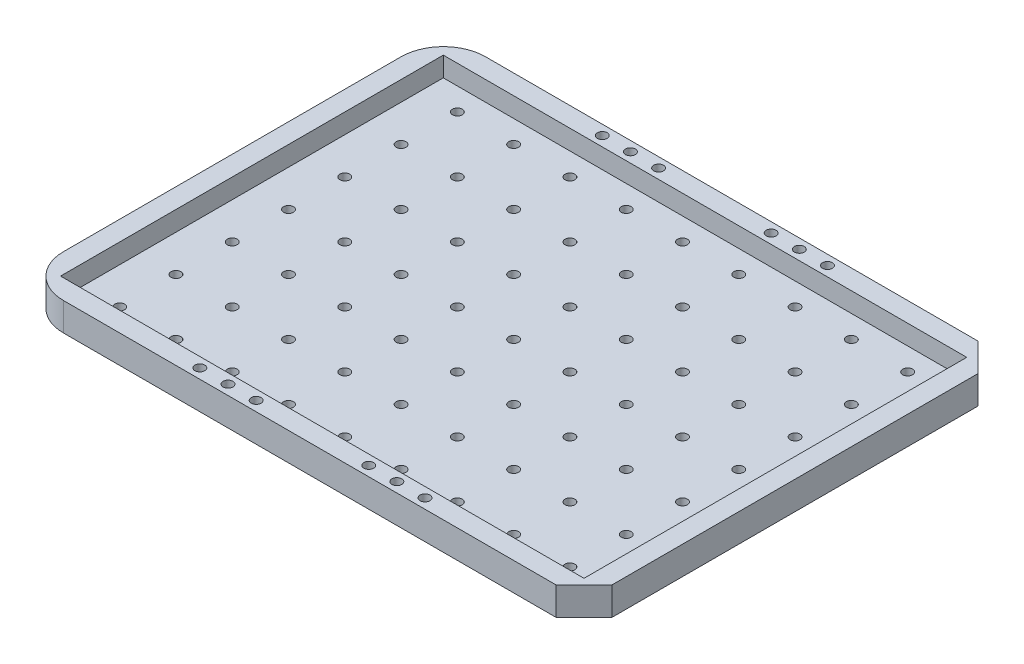
from build123d import *

# Parameters (mm, degrees)
SKETCH1_W                   = 200
SKETCH1_H                   = 150
CHASIS_DEPTH                = 10
SKETCH2_W                   = 186
SKETCH2_H                   = 136
CHASIS_EDGE_DEPTH           = 7
HOLE_PATTERN_R              = 1.75
GENERAL_PURPOSE_HOLES_DEPTH = 251.0979808
SKETCH16_R                  = 1.75
CUT_EXTRUDE4_DEPTH          = 251.199920064
CHAMFER2_SIZE               = 10
FILLET2_R                   = 15


with BuildPart() as part:
    # Sketch1 → Chasis (new body)
    with BuildSketch(Plane(origin=(0, 0, 0), x_dir=(1, 0, 0), z_dir=(0, 1, 0))):
        with Locations((100, 75)):
            Rectangle(SKETCH1_W, SKETCH1_H)
    extrude(amount=CHASIS_DEPTH)

    # Sketch2 → Chasis Edge (cut)
    with BuildSketch(Plane(origin=(0, 10, 0), x_dir=(1, 0, 0), z_dir=(0, 1, 0))):
        with Locations((100, 75)):
            Rectangle(SKETCH2_W, SKETCH2_H)
    extrude(amount=-CHASIS_EDGE_DEPTH, mode=Mode.SUBTRACT)

    # Hole Pattern → General Purpose Holes (cut, through all)
    with BuildSketch(Plane(origin=(0, 3, 0), x_dir=(1, 0, 0), z_dir=(0, 1, 0))):
        with Locations(Location((20, 135, 0), (0, 0, 270))):
            Circle(HOLE_PATTERN_R)
        with Locations(Location((40, 135, 0), (0, 0, 270))):
            Circle(HOLE_PATTERN_R)
        with Locations(Location((60, 135, 0), (0, 0, 270))):
            Circle(HOLE_PATTERN_R)
        with Locations(Location((80, 135, 0), (0, 0, 270))):
            Circle(HOLE_PATTERN_R)
        with Locations(Location((100, 135, 0), (0, 0, 270))):
            Circle(HOLE_PATTERN_R)
        with Locations(Location((120, 135, 0), (0, 0, 270))):
            Circle(HOLE_PATTERN_R)
        with Locations(Location((140, 135, 0), (0, 0, 270))):
            Circle(HOLE_PATTERN_R)
        with Locations(Location((160, 135, 0), (0, 0, 270))):
            Circle(HOLE_PATTERN_R)
        with Locations(Location((180, 135, 0), (0, 0, 270))):
            Circle(HOLE_PATTERN_R)
        with Locations(Location((20, 115, 0), (0, 0, 270))):
            Circle(HOLE_PATTERN_R)
        with Locations(Location((40, 115, 0), (0, 0, 270))):
            Circle(HOLE_PATTERN_R)
        with Locations(Location((60, 115, 0), (0, 0, 270))):
            Circle(HOLE_PATTERN_R)
        with Locations(Location((80, 115, 0), (0, 0, 270))):
            Circle(HOLE_PATTERN_R)
        with Locations(Location((100, 115, 0), (0, 0, 270))):
            Circle(HOLE_PATTERN_R)
        with Locations(Location((120, 115, 0), (0, 0, 270))):
            Circle(HOLE_PATTERN_R)
        with Locations(Location((140, 115, 0), (0, 0, 270))):
            Circle(HOLE_PATTERN_R)
        with Locations(Location((160, 115, 0), (0, 0, 270))):
            Circle(HOLE_PATTERN_R)
        with Locations(Location((180, 115, 0), (0, 0, 270))):
            Circle(HOLE_PATTERN_R)
        with Locations(Location((20, 95, 0), (0, 0, 270))):
            Circle(HOLE_PATTERN_R)
        with Locations(Location((40, 95, 0), (0, 0, 270))):
            Circle(HOLE_PATTERN_R)
        with Locations(Location((60, 95, 0), (0, 0, 270))):
            Circle(HOLE_PATTERN_R)
        with Locations(Location((80, 95, 0), (0, 0, 270))):
            Circle(HOLE_PATTERN_R)
        with Locations(Location((100, 95, 0), (0, 0, 270))):
            Circle(HOLE_PATTERN_R)
        with Locations(Location((120, 95, 0), (0, 0, 270))):
            Circle(HOLE_PATTERN_R)
        with Locations(Location((140, 95, 0), (0, 0, 270))):
            Circle(HOLE_PATTERN_R)
        with Locations(Location((160, 95, 0), (0, 0, 270))):
            Circle(HOLE_PATTERN_R)
        with Locations(Location((180, 95, 0), (0, 0, 270))):
            Circle(HOLE_PATTERN_R)
        with Locations(Location((20, 75, 0), (0, 0, 270))):
            Circle(HOLE_PATTERN_R)
        with Locations(Location((40, 75, 0), (0, 0, 270))):
            Circle(HOLE_PATTERN_R)
        with Locations(Location((60, 75, 0), (0, 0, 270))):
            Circle(HOLE_PATTERN_R)
        with Locations(Location((80, 75, 0), (0, 0, 270))):
            Circle(HOLE_PATTERN_R)
        with Locations(Location((100, 75, 0), (0, 0, 270))):
            Circle(HOLE_PATTERN_R)
        with Locations(Location((120, 75, 0), (0, 0, 270))):
            Circle(HOLE_PATTERN_R)
        with Locations(Location((140, 75, 0), (0, 0, 270))):
            Circle(HOLE_PATTERN_R)
        with Locations(Location((160, 75, 0), (0, 0, 270))):
            Circle(HOLE_PATTERN_R)
        with Locations(Location((180, 75, 0), (0, 0, 270))):
            Circle(HOLE_PATTERN_R)
        with Locations(Location((20, 55, 0), (0, 0, 270))):
            Circle(HOLE_PATTERN_R)
        with Locations(Location((40, 55, 0), (0, 0, 270))):
            Circle(HOLE_PATTERN_R)
        with Locations(Location((60, 55, 0), (0, 0, 270))):
            Circle(HOLE_PATTERN_R)
        with Locations(Location((80, 55, 0), (0, 0, 270))):
            Circle(HOLE_PATTERN_R)
        with Locations(Location((100, 55, 0), (0, 0, 270))):
            Circle(HOLE_PATTERN_R)
        with Locations(Location((120, 55, 0), (0, 0, 270))):
            Circle(HOLE_PATTERN_R)
        with Locations(Location((140, 55, 0), (0, 0, 270))):
            Circle(HOLE_PATTERN_R)
        with Locations(Location((160, 55, 0), (0, 0, 270))):
            Circle(HOLE_PATTERN_R)
        with Locations(Location((180, 55, 0), (0, 0, 270))):
            Circle(HOLE_PATTERN_R)
        with Locations(Location((20, 35, 0), (0, 0, 270))):
            Circle(HOLE_PATTERN_R)
        with Locations(Location((40, 35, 0), (0, 0, 270))):
            Circle(HOLE_PATTERN_R)
        with Locations(Location((60, 35, 0), (0, 0, 270))):
            Circle(HOLE_PATTERN_R)
        with Locations(Location((80, 35, 0), (0, 0, 270))):
            Circle(HOLE_PATTERN_R)
        with Locations(Location((100, 35, 0), (0, 0, 270))):
            Circle(HOLE_PATTERN_R)
        with Locations(Location((120, 35, 0), (0, 0, 270))):
            Circle(HOLE_PATTERN_R)
        with Locations(Location((140, 35, 0), (0, 0, 270))):
            Circle(HOLE_PATTERN_R)
        with Locations(Location((160, 35, 0), (0, 0, 270))):
            Circle(HOLE_PATTERN_R)
        with Locations(Location((180, 35, 0), (0, 0, 270))):
            Circle(HOLE_PATTERN_R)
        with Locations(Location((20, 15, 0), (0, 0, 270))):
            Circle(HOLE_PATTERN_R)
        with Locations(Location((40, 15, 0), (0, 0, 270))):
            Circle(HOLE_PATTERN_R)
        with Locations(Location((60, 15, 0), (0, 0, 270))):
            Circle(HOLE_PATTERN_R)
        with Locations(Location((80, 15, 0), (0, 0, 270))):
            Circle(HOLE_PATTERN_R)
        with Locations(Location((100, 15, 0), (0, 0, 270))):
            Circle(HOLE_PATTERN_R)
        with Locations(Location((120, 15, 0), (0, 0, 270))):
            Circle(HOLE_PATTERN_R)
        with Locations(Location((140, 15, 0), (0, 0, 270))):
            Circle(HOLE_PATTERN_R)
        with Locations(Location((160, 15, 0), (0, 0, 270))):
            Circle(HOLE_PATTERN_R)
        with Locations(Location((180, 15, 0), (0, 0, 270))):
            Circle(HOLE_PATTERN_R)
    extrude(amount=-GENERAL_PURPOSE_HOLES_DEPTH, mode=Mode.SUBTRACT)

    # Sketch16 → Cut-Extrude4 (cut, through all)
    with BuildSketch(Plane(origin=(0, 10, 0), x_dir=(1, 0, 0), z_dir=(0, 1, 0))):
        with Locations(Location((130, 146.5, 0), (0, 0, 270))):
            Circle(SKETCH16_R)
        with Locations(Location((120, 146.5, 0), (0, 0, 270))):
            Circle(SKETCH16_R)
        with Locations(Location((140, 146.5, 0), (0, 0, 270))):
            Circle(SKETCH16_R)
        with Locations(Location((140, 3.5, 0), (0, 0, 90))):
            Circle(SKETCH16_R)
        with Locations(Location((120, 3.5, 0), (0, 0, 90))):
            Circle(SKETCH16_R)
        with Locations(Location((130, 3.5, 0), (0, 0, 90))):
            Circle(SKETCH16_R)
        with Locations(Location((70, 3.5, 0), (0, 0, 270))):
            Circle(SKETCH16_R)
        with Locations(Location((80, 3.5, 0), (0, 0, 270))):
            Circle(SKETCH16_R)
        with Locations(Location((60, 3.5, 0), (0, 0, 270))):
            Circle(SKETCH16_R)
        with Locations(Location((60, 146.5, 0), (0, 0, 90))):
            Circle(SKETCH16_R)
        with Locations(Location((80, 146.5, 0), (0, 0, 90))):
            Circle(SKETCH16_R)
        with Locations(Location((70, 146.5, 0), (0, 0, 90))):
            Circle(SKETCH16_R)
    extrude(amount=-CUT_EXTRUDE4_DEPTH, mode=Mode.SUBTRACT)

    # Chamfer2
    chamfer2_edges = [part.edges().sort_by_distance(p)[0] for p in [
        (200, 5, -150),
        (200, 5, 0),
    ]]
    chamfer(chamfer2_edges, length=CHAMFER2_SIZE)

    # Fillet2
    fillet2_edges = [part.edges().sort_by_distance(p)[0] for p in [
        (0, 5, -150),
        (0, 5, 0),
    ]]
    fillet(fillet2_edges, radius=FILLET2_R)


solid = part.part
